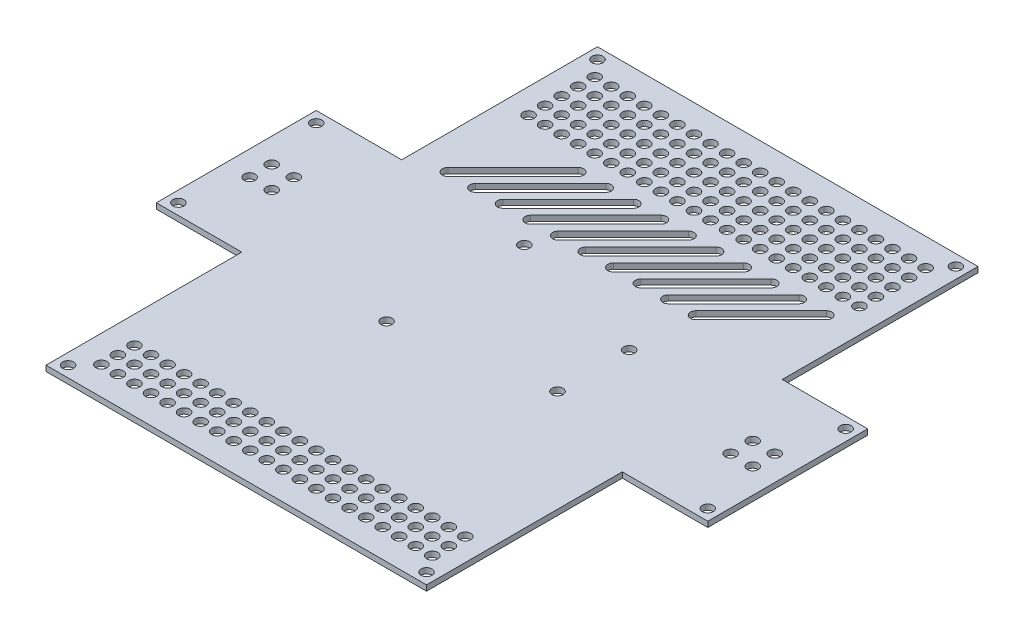
from build123d import *

# Parameters (mm, degrees)
SKETCH1_R           = 2
BOSS_EXTRUDE1_DEPTH = 2


with BuildPart() as part:
    # Sketch1 → Boss-Extrude1 (new body)
    with BuildSketch(Plane(origin=(0, 0, 0), x_dir=(1, 0, 0), z_dir=(0, 1, 0))):
        Polygon((-69, -100), (69, -100), (69, -29), (100, -29), (100, 29), (69, 29), (69, 100), (-69, 100), (-69, 29), (-100, 29), (-100, -29), (-69, -29), align=None)
        with Locations(Location((65, 96, 0), (0, 0, 270))):
            Circle(SKETCH1_R, mode=Mode.SUBTRACT)
        with Locations(Location((-65, 96, 0), (0, 0, 270))):
            Circle(SKETCH1_R, mode=Mode.SUBTRACT)
        with Locations(Location((96, 25, 0), (0, 0, 270))):
            Circle(SKETCH1_R, mode=Mode.SUBTRACT)
        with Locations(Location((96, -25, 0), (0, 0, 270))):
            Circle(SKETCH1_R, mode=Mode.SUBTRACT)
        with Locations(Location((65, -96, 0), (0, 0, 270))):
            Circle(SKETCH1_R, mode=Mode.SUBTRACT)
        with Locations(Location((-65, -96, 0), (0, 0, 270))):
            Circle(SKETCH1_R, mode=Mode.SUBTRACT)
        with Locations(Location((-96, -25, 0), (0, 0, 270))):
            Circle(SKETCH1_R, mode=Mode.SUBTRACT)
        with Locations(Location((-96, 25, 0), (0, 0, 270))):
            Circle(SKETCH1_R, mode=Mode.SUBTRACT)
        with Locations(Location((-60, 90, 0), (0, 0, 270))):
            Circle(SKETCH1_R, mode=Mode.SUBTRACT)
        with Locations(Location((-54, 90, 0), (0, 0, 270))):
            Circle(SKETCH1_R, mode=Mode.SUBTRACT)
        with Locations(Location((-48, 90, 0), (0, 0, 270))):
            Circle(SKETCH1_R, mode=Mode.SUBTRACT)
        with Locations(Location((-42, 90, 0), (0, 0, 270))):
            Circle(SKETCH1_R, mode=Mode.SUBTRACT)
        with Locations(Location((-36, 90, 0), (0, 0, 270))):
            Circle(SKETCH1_R, mode=Mode.SUBTRACT)
        with Locations(Location((-30, 90, 0), (0, 0, 270))):
            Circle(SKETCH1_R, mode=Mode.SUBTRACT)
        with Locations(Location((-24, 90, 0), (0, 0, 270))):
            Circle(SKETCH1_R, mode=Mode.SUBTRACT)
        with Locations(Location((-18, 90, 0), (0, 0, 270))):
            Circle(SKETCH1_R, mode=Mode.SUBTRACT)
        with Locations(Location((-12, 90, 0), (0, 0, 270))):
            Circle(SKETCH1_R, mode=Mode.SUBTRACT)
        with Locations(Location((-6, 90, 0), (0, 0, 270))):
            Circle(SKETCH1_R, mode=Mode.SUBTRACT)
        with Locations(Location((0, 90, 0), (0, 0, 270))):
            Circle(SKETCH1_R, mode=Mode.SUBTRACT)
        with Locations(Location((6, 90, 0), (0, 0, 270))):
            Circle(SKETCH1_R, mode=Mode.SUBTRACT)
        with Locations(Location((12, 90, 0), (0, 0, 270))):
            Circle(SKETCH1_R, mode=Mode.SUBTRACT)
        with Locations(Location((18, 90, 0), (0, 0, 270))):
            Circle(SKETCH1_R, mode=Mode.SUBTRACT)
        with Locations(Location((24, 90, 0), (0, 0, 270))):
            Circle(SKETCH1_R, mode=Mode.SUBTRACT)
        with Locations(Location((30, 90, 0), (0, 0, 270))):
            Circle(SKETCH1_R, mode=Mode.SUBTRACT)
        with Locations(Location((36, 90, 0), (0, 0, 270))):
            Circle(SKETCH1_R, mode=Mode.SUBTRACT)
        with Locations(Location((42, 90, 0), (0, 0, 270))):
            Circle(SKETCH1_R, mode=Mode.SUBTRACT)
        with Locations(Location((48, 90, 0), (0, 0, 270))):
            Circle(SKETCH1_R, mode=Mode.SUBTRACT)
        with Locations(Location((54, 90, 0), (0, 0, 270))):
            Circle(SKETCH1_R, mode=Mode.SUBTRACT)
        with Locations(Location((60, 90, 0), (0, 0, 270))):
            Circle(SKETCH1_R, mode=Mode.SUBTRACT)
        with Locations(Location((-54, 84, 0), (0, 0, 270))):
            Circle(SKETCH1_R, mode=Mode.SUBTRACT)
        with Locations(Location((-48, 84, 0), (0, 0, 270))):
            Circle(SKETCH1_R, mode=Mode.SUBTRACT)
        with Locations(Location((-42, 84, 0), (0, 0, 270))):
            Circle(SKETCH1_R, mode=Mode.SUBTRACT)
        with Locations(Location((-36, 84, 0), (0, 0, 270))):
            Circle(SKETCH1_R, mode=Mode.SUBTRACT)
        with Locations(Location((-30, 84, 0), (0, 0, 270))):
            Circle(SKETCH1_R, mode=Mode.SUBTRACT)
        with Locations(Location((-24, 84, 0), (0, 0, 270))):
            Circle(SKETCH1_R, mode=Mode.SUBTRACT)
        with Locations(Location((-18, 84, 0), (0, 0, 270))):
            Circle(SKETCH1_R, mode=Mode.SUBTRACT)
        with Locations(Location((-12, 84, 0), (0, 0, 270))):
            Circle(SKETCH1_R, mode=Mode.SUBTRACT)
        with Locations(Location((-6, 84, 0), (0, 0, 270))):
            Circle(SKETCH1_R, mode=Mode.SUBTRACT)
        with Locations(Location((0, 84, 0), (0, 0, 270))):
            Circle(SKETCH1_R, mode=Mode.SUBTRACT)
        with Locations(Location((6, 84, 0), (0, 0, 270))):
            Circle(SKETCH1_R, mode=Mode.SUBTRACT)
        with Locations(Location((12, 84, 0), (0, 0, 270))):
            Circle(SKETCH1_R, mode=Mode.SUBTRACT)
        with Locations(Location((18, 84, 0), (0, 0, 270))):
            Circle(SKETCH1_R, mode=Mode.SUBTRACT)
        with Locations(Location((24, 84, 0), (0, 0, 270))):
            Circle(SKETCH1_R, mode=Mode.SUBTRACT)
        with Locations(Location((30, 84, 0), (0, 0, 270))):
            Circle(SKETCH1_R, mode=Mode.SUBTRACT)
        with Locations(Location((36, 84, 0), (0, 0, 270))):
            Circle(SKETCH1_R, mode=Mode.SUBTRACT)
        with Locations(Location((42, 84, 0), (0, 0, 270))):
            Circle(SKETCH1_R, mode=Mode.SUBTRACT)
        with Locations(Location((48, 84, 0), (0, 0, 270))):
            Circle(SKETCH1_R, mode=Mode.SUBTRACT)
        with Locations(Location((54, 84, 0), (0, 0, 270))):
            Circle(SKETCH1_R, mode=Mode.SUBTRACT)
        with Locations(Location((60, 84, 0), (0, 0, 270))):
            Circle(SKETCH1_R, mode=Mode.SUBTRACT)
        with Locations(Location((-54, 78, 0), (0, 0, 270))):
            Circle(SKETCH1_R, mode=Mode.SUBTRACT)
        with Locations(Location((-48, 78, 0), (0, 0, 270))):
            Circle(SKETCH1_R, mode=Mode.SUBTRACT)
        with Locations(Location((-42, 78, 0), (0, 0, 270))):
            Circle(SKETCH1_R, mode=Mode.SUBTRACT)
        with Locations(Location((-36, 78, 0), (0, 0, 270))):
            Circle(SKETCH1_R, mode=Mode.SUBTRACT)
        with Locations(Location((-30, 78, 0), (0, 0, 270))):
            Circle(SKETCH1_R, mode=Mode.SUBTRACT)
        with Locations(Location((-24, 78, 0), (0, 0, 270))):
            Circle(SKETCH1_R, mode=Mode.SUBTRACT)
        with Locations(Location((-18, 78, 0), (0, 0, 270))):
            Circle(SKETCH1_R, mode=Mode.SUBTRACT)
        with Locations(Location((-12, 78, 0), (0, 0, 270))):
            Circle(SKETCH1_R, mode=Mode.SUBTRACT)
        with Locations(Location((-6, 78, 0), (0, 0, 270))):
            Circle(SKETCH1_R, mode=Mode.SUBTRACT)
        with Locations(Location((0, 78, 0), (0, 0, 270))):
            Circle(SKETCH1_R, mode=Mode.SUBTRACT)
        with Locations(Location((6, 78, 0), (0, 0, 270))):
            Circle(SKETCH1_R, mode=Mode.SUBTRACT)
        with Locations(Location((12, 78, 0), (0, 0, 270))):
            Circle(SKETCH1_R, mode=Mode.SUBTRACT)
        with Locations(Location((18, 78, 0), (0, 0, 270))):
            Circle(SKETCH1_R, mode=Mode.SUBTRACT)
        with Locations(Location((24, 78, 0), (0, 0, 270))):
            Circle(SKETCH1_R, mode=Mode.SUBTRACT)
        with Locations(Location((30, 78, 0), (0, 0, 270))):
            Circle(SKETCH1_R, mode=Mode.SUBTRACT)
        with Locations(Location((36, 78, 0), (0, 0, 270))):
            Circle(SKETCH1_R, mode=Mode.SUBTRACT)
        with Locations(Location((42, 78, 0), (0, 0, 270))):
            Circle(SKETCH1_R, mode=Mode.SUBTRACT)
        with Locations(Location((48, 78, 0), (0, 0, 270))):
            Circle(SKETCH1_R, mode=Mode.SUBTRACT)
        with Locations(Location((54, 78, 0), (0, 0, 270))):
            Circle(SKETCH1_R, mode=Mode.SUBTRACT)
        with Locations(Location((60, 78, 0), (0, 0, 270))):
            Circle(SKETCH1_R, mode=Mode.SUBTRACT)
        with Locations(Location((-54, 72, 0), (0, 0, 270))):
            Circle(SKETCH1_R, mode=Mode.SUBTRACT)
        with Locations(Location((-48, 72, 0), (0, 0, 270))):
            Circle(SKETCH1_R, mode=Mode.SUBTRACT)
        with Locations(Location((-42, 72, 0), (0, 0, 270))):
            Circle(SKETCH1_R, mode=Mode.SUBTRACT)
        with Locations(Location((-36, 72, 0), (0, 0, 270))):
            Circle(SKETCH1_R, mode=Mode.SUBTRACT)
        with Locations(Location((-30, 72, 0), (0, 0, 270))):
            Circle(SKETCH1_R, mode=Mode.SUBTRACT)
        with Locations(Location((-24, 72, 0), (0, 0, 270))):
            Circle(SKETCH1_R, mode=Mode.SUBTRACT)
        with Locations(Location((-18, 72, 0), (0, 0, 270))):
            Circle(SKETCH1_R, mode=Mode.SUBTRACT)
        with Locations(Location((-12, 72, 0), (0, 0, 270))):
            Circle(SKETCH1_R, mode=Mode.SUBTRACT)
        with Locations(Location((-6, 72, 0), (0, 0, 270))):
            Circle(SKETCH1_R, mode=Mode.SUBTRACT)
        with Locations(Location((0, 72, 0), (0, 0, 270))):
            Circle(SKETCH1_R, mode=Mode.SUBTRACT)
        with Locations(Location((6, 72, 0), (0, 0, 270))):
            Circle(SKETCH1_R, mode=Mode.SUBTRACT)
        with Locations(Location((12, 72, 0), (0, 0, 270))):
            Circle(SKETCH1_R, mode=Mode.SUBTRACT)
        with Locations(Location((18, 72, 0), (0, 0, 270))):
            Circle(SKETCH1_R, mode=Mode.SUBTRACT)
        with Locations(Location((24, 72, 0), (0, 0, 270))):
            Circle(SKETCH1_R, mode=Mode.SUBTRACT)
        with Locations(Location((30, 72, 0), (0, 0, 270))):
            Circle(SKETCH1_R, mode=Mode.SUBTRACT)
        with Locations(Location((36, 72, 0), (0, 0, 270))):
            Circle(SKETCH1_R, mode=Mode.SUBTRACT)
        with Locations(Location((42, 72, 0), (0, 0, 270))):
            Circle(SKETCH1_R, mode=Mode.SUBTRACT)
        with Locations(Location((48, 72, 0), (0, 0, 270))):
            Circle(SKETCH1_R, mode=Mode.SUBTRACT)
        with Locations(Location((54, 72, 0), (0, 0, 270))):
            Circle(SKETCH1_R, mode=Mode.SUBTRACT)
        with Locations(Location((60, 72, 0), (0, 0, 270))):
            Circle(SKETCH1_R, mode=Mode.SUBTRACT)
        with Locations(Location((-54, 66, 0), (0, 0, 270))):
            Circle(SKETCH1_R, mode=Mode.SUBTRACT)
        with Locations(Location((-48, 66, 0), (0, 0, 270))):
            Circle(SKETCH1_R, mode=Mode.SUBTRACT)
        with Locations(Location((-42, 66, 0), (0, 0, 270))):
            Circle(SKETCH1_R, mode=Mode.SUBTRACT)
        with Locations(Location((-36, 66, 0), (0, 0, 270))):
            Circle(SKETCH1_R, mode=Mode.SUBTRACT)
        with Locations(Location((-30, 66, 0), (0, 0, 270))):
            Circle(SKETCH1_R, mode=Mode.SUBTRACT)
        with Locations(Location((-24, 66, 0), (0, 0, 270))):
            Circle(SKETCH1_R, mode=Mode.SUBTRACT)
        with Locations(Location((-18, 66, 0), (0, 0, 270))):
            Circle(SKETCH1_R, mode=Mode.SUBTRACT)
        with Locations(Location((-12, 66, 0), (0, 0, 270))):
            Circle(SKETCH1_R, mode=Mode.SUBTRACT)
        with Locations(Location((-6, 66, 0), (0, 0, 270))):
            Circle(SKETCH1_R, mode=Mode.SUBTRACT)
        with Locations(Location((0, 66, 0), (0, 0, 270))):
            Circle(SKETCH1_R, mode=Mode.SUBTRACT)
        with Locations(Location((6, 66, 0), (0, 0, 270))):
            Circle(SKETCH1_R, mode=Mode.SUBTRACT)
        with Locations(Location((12, 66, 0), (0, 0, 270))):
            Circle(SKETCH1_R, mode=Mode.SUBTRACT)
        with Locations(Location((18, 66, 0), (0, 0, 270))):
            Circle(SKETCH1_R, mode=Mode.SUBTRACT)
        with Locations(Location((24, 66, 0), (0, 0, 270))):
            Circle(SKETCH1_R, mode=Mode.SUBTRACT)
        with Locations(Location((30, 66, 0), (0, 0, 270))):
            Circle(SKETCH1_R, mode=Mode.SUBTRACT)
        with Locations(Location((36, 66, 0), (0, 0, 270))):
            Circle(SKETCH1_R, mode=Mode.SUBTRACT)
        with Locations(Location((42, 66, 0), (0, 0, 270))):
            Circle(SKETCH1_R, mode=Mode.SUBTRACT)
        with Locations(Location((48, 66, 0), (0, 0, 270))):
            Circle(SKETCH1_R, mode=Mode.SUBTRACT)
        with Locations(Location((54, 66, 0), (0, 0, 270))):
            Circle(SKETCH1_R, mode=Mode.SUBTRACT)
        with Locations(Location((60, 66, 0), (0, 0, 270))):
            Circle(SKETCH1_R, mode=Mode.SUBTRACT)
        with Locations(Location((-53.147053671, -77.771185697, 0), (0, 0, 270))):
            Circle(SKETCH1_R, mode=Mode.SUBTRACT)
        with Locations(Location((-47.147053671, -77.771185697, 0), (0, 0, 270))):
            Circle(SKETCH1_R, mode=Mode.SUBTRACT)
        with Locations(Location((-41.147053671, -77.771185697, 0), (0, 0, 270))):
            Circle(SKETCH1_R, mode=Mode.SUBTRACT)
        with Locations(Location((-35.147053671, -77.771185697, 0), (0, 0, 270))):
            Circle(SKETCH1_R, mode=Mode.SUBTRACT)
        with Locations(Location((-29.147053671, -77.771185697, 0), (0, 0, 270))):
            Circle(SKETCH1_R, mode=Mode.SUBTRACT)
        with Locations(Location((-23.147053671, -77.771185697, 0), (0, 0, 270))):
            Circle(SKETCH1_R, mode=Mode.SUBTRACT)
        with Locations(Location((-17.147053671, -77.771185697, 0), (0, 0, 270))):
            Circle(SKETCH1_R, mode=Mode.SUBTRACT)
        with Locations(Location((-11.147053671, -77.771185697, 0), (0, 0, 270))):
            Circle(SKETCH1_R, mode=Mode.SUBTRACT)
        with Locations(Location((-5.147053671, -77.771185697, 0), (0, 0, 270))):
            Circle(SKETCH1_R, mode=Mode.SUBTRACT)
        with Locations(Location((0.852946329, -77.771185697, 0), (0, 0, 270))):
            Circle(SKETCH1_R, mode=Mode.SUBTRACT)
        with Locations(Location((6.852946329, -77.771185697, 0), (0, 0, 270))):
            Circle(SKETCH1_R, mode=Mode.SUBTRACT)
        with Locations(Location((12.852946329, -77.771185697, 0), (0, 0, 270))):
            Circle(SKETCH1_R, mode=Mode.SUBTRACT)
        with Locations(Location((18.852946329, -77.771185697, 0), (0, 0, 270))):
            Circle(SKETCH1_R, mode=Mode.SUBTRACT)
        with Locations(Location((24.852946329, -77.771185697, 0), (0, 0, 270))):
            Circle(SKETCH1_R, mode=Mode.SUBTRACT)
        with Locations(Location((30.852946329, -77.771185697, 0), (0, 0, 270))):
            Circle(SKETCH1_R, mode=Mode.SUBTRACT)
        with Locations(Location((36.852946329, -77.771185697, 0), (0, 0, 270))):
            Circle(SKETCH1_R, mode=Mode.SUBTRACT)
        with Locations(Location((42.852946329, -77.771185697, 0), (0, 0, 270))):
            Circle(SKETCH1_R, mode=Mode.SUBTRACT)
        with Locations(Location((48.852946329, -77.771185697, 0), (0, 0, 270))):
            Circle(SKETCH1_R, mode=Mode.SUBTRACT)
        with Locations(Location((54.852946329, -77.771185697, 0), (0, 0, 270))):
            Circle(SKETCH1_R, mode=Mode.SUBTRACT)
        with Locations(Location((60.852946329, -77.771185697, 0), (0, 0, 270))):
            Circle(SKETCH1_R, mode=Mode.SUBTRACT)
        with Locations(Location((-53.147053671, -83.771185697, 0), (0, 0, 270))):
            Circle(SKETCH1_R, mode=Mode.SUBTRACT)
        with Locations(Location((-47.147053671, -83.771185697, 0), (0, 0, 270))):
            Circle(SKETCH1_R, mode=Mode.SUBTRACT)
        with Locations(Location((-41.147053671, -83.771185697, 0), (0, 0, 270))):
            Circle(SKETCH1_R, mode=Mode.SUBTRACT)
        with Locations(Location((-35.147053671, -83.771185697, 0), (0, 0, 270))):
            Circle(SKETCH1_R, mode=Mode.SUBTRACT)
        with Locations(Location((-29.147053671, -83.771185697, 0), (0, 0, 270))):
            Circle(SKETCH1_R, mode=Mode.SUBTRACT)
        with Locations(Location((-23.147053671, -83.771185697, 0), (0, 0, 270))):
            Circle(SKETCH1_R, mode=Mode.SUBTRACT)
        with Locations(Location((-17.147053671, -83.771185697, 0), (0, 0, 270))):
            Circle(SKETCH1_R, mode=Mode.SUBTRACT)
        with Locations(Location((-11.147053671, -83.771185697, 0), (0, 0, 270))):
            Circle(SKETCH1_R, mode=Mode.SUBTRACT)
        with Locations(Location((-5.147053671, -83.771185697, 0), (0, 0, 270))):
            Circle(SKETCH1_R, mode=Mode.SUBTRACT)
        with Locations(Location((0.852946329, -83.771185697, 0), (0, 0, 270))):
            Circle(SKETCH1_R, mode=Mode.SUBTRACT)
        with Locations(Location((6.852946329, -83.771185697, 0), (0, 0, 270))):
            Circle(SKETCH1_R, mode=Mode.SUBTRACT)
        with Locations(Location((12.852946329, -83.771185697, 0), (0, 0, 270))):
            Circle(SKETCH1_R, mode=Mode.SUBTRACT)
        with Locations(Location((18.852946329, -83.771185697, 0), (0, 0, 270))):
            Circle(SKETCH1_R, mode=Mode.SUBTRACT)
        with Locations(Location((24.852946329, -83.771185697, 0), (0, 0, 270))):
            Circle(SKETCH1_R, mode=Mode.SUBTRACT)
        with Locations(Location((30.852946329, -83.771185697, 0), (0, 0, 270))):
            Circle(SKETCH1_R, mode=Mode.SUBTRACT)
        with Locations(Location((36.852946329, -83.771185697, 0), (0, 0, 270))):
            Circle(SKETCH1_R, mode=Mode.SUBTRACT)
        with Locations(Location((42.852946329, -83.771185697, 0), (0, 0, 270))):
            Circle(SKETCH1_R, mode=Mode.SUBTRACT)
        with Locations(Location((48.852946329, -83.771185697, 0), (0, 0, 270))):
            Circle(SKETCH1_R, mode=Mode.SUBTRACT)
        with Locations(Location((54.852946329, -83.771185697, 0), (0, 0, 270))):
            Circle(SKETCH1_R, mode=Mode.SUBTRACT)
        with Locations(Location((60.852946329, -83.771185697, 0), (0, 0, 270))):
            Circle(SKETCH1_R, mode=Mode.SUBTRACT)
        with Locations(Location((-53.147053671, -89.771185697, 0), (0, 0, 270))):
            Circle(SKETCH1_R, mode=Mode.SUBTRACT)
        with Locations(Location((-47.147053671, -89.771185697, 0), (0, 0, 270))):
            Circle(SKETCH1_R, mode=Mode.SUBTRACT)
        with Locations(Location((-41.147053671, -89.771185697, 0), (0, 0, 270))):
            Circle(SKETCH1_R, mode=Mode.SUBTRACT)
        with Locations(Location((-35.147053671, -89.771185697, 0), (0, 0, 270))):
            Circle(SKETCH1_R, mode=Mode.SUBTRACT)
        with Locations(Location((-29.147053671, -89.771185697, 0), (0, 0, 270))):
            Circle(SKETCH1_R, mode=Mode.SUBTRACT)
        with Locations(Location((-23.147053671, -89.771185697, 0), (0, 0, 270))):
            Circle(SKETCH1_R, mode=Mode.SUBTRACT)
        with Locations(Location((-17.147053671, -89.771185697, 0), (0, 0, 270))):
            Circle(SKETCH1_R, mode=Mode.SUBTRACT)
        with Locations(Location((-11.147053671, -89.771185697, 0), (0, 0, 270))):
            Circle(SKETCH1_R, mode=Mode.SUBTRACT)
        with Locations(Location((-5.147053671, -89.771185697, 0), (0, 0, 270))):
            Circle(SKETCH1_R, mode=Mode.SUBTRACT)
        with Locations(Location((0.852946329, -89.771185697, 0), (0, 0, 270))):
            Circle(SKETCH1_R, mode=Mode.SUBTRACT)
        with Locations(Location((6.852946329, -89.771185697, 0), (0, 0, 270))):
            Circle(SKETCH1_R, mode=Mode.SUBTRACT)
        with Locations(Location((12.852946329, -89.771185697, 0), (0, 0, 270))):
            Circle(SKETCH1_R, mode=Mode.SUBTRACT)
        with Locations(Location((18.852946329, -89.771185697, 0), (0, 0, 270))):
            Circle(SKETCH1_R, mode=Mode.SUBTRACT)
        with Locations(Location((24.852946329, -89.771185697, 0), (0, 0, 270))):
            Circle(SKETCH1_R, mode=Mode.SUBTRACT)
        with Locations(Location((30.852946329, -89.771185697, 0), (0, 0, 270))):
            Circle(SKETCH1_R, mode=Mode.SUBTRACT)
        with Locations(Location((36.852946329, -89.771185697, 0), (0, 0, 270))):
            Circle(SKETCH1_R, mode=Mode.SUBTRACT)
        with Locations(Location((42.852946329, -89.771185697, 0), (0, 0, 270))):
            Circle(SKETCH1_R, mode=Mode.SUBTRACT)
        with Locations(Location((48.852946329, -89.771185697, 0), (0, 0, 270))):
            Circle(SKETCH1_R, mode=Mode.SUBTRACT)
        with Locations(Location((54.852946329, -89.771185697, 0), (0, 0, 270))):
            Circle(SKETCH1_R, mode=Mode.SUBTRACT)
        with Locations(Location((60.852946329, -89.771185697, 0), (0, 0, 270))):
            Circle(SKETCH1_R, mode=Mode.SUBTRACT)
        with Locations(Location((-60, 84, 0), (0, 0, 270))):
            Circle(SKETCH1_R, mode=Mode.SUBTRACT)
        with Locations(Location((-60, 78, 0), (0, 0, 270))):
            Circle(SKETCH1_R, mode=Mode.SUBTRACT)
        with Locations(Location((-60, 72, 0), (0, 0, 270))):
            Circle(SKETCH1_R, mode=Mode.SUBTRACT)
        with Locations(Location((-60, 66, 0), (0, 0, 270))):
            Circle(SKETCH1_R, mode=Mode.SUBTRACT)
        with Locations(Location((-59.147053671, -77.771185697, 0), (0, 0, 270))):
            Circle(SKETCH1_R, mode=Mode.SUBTRACT)
        with Locations(Location((-59.147053671, -83.771185697, 0), (0, 0, 270))):
            Circle(SKETCH1_R, mode=Mode.SUBTRACT)
        with Locations(Location((-59.147053671, -89.771185697, 0), (0, 0, 270))):
            Circle(SKETCH1_R, mode=Mode.SUBTRACT)
        with Locations(Location((-20, 24.5, 0), (0, 0, 270))):
            Circle(SKETCH1_R, mode=Mode.SUBTRACT)
        with Locations(Location((32, 10.5, 0), (0, 0, 270))):
            Circle(SKETCH1_R, mode=Mode.SUBTRACT)
        with Locations(Location((32, -15.5, 0), (0, 0, 270))):
            Circle(SKETCH1_R, mode=Mode.SUBTRACT)
        with Locations(Location((-21, -24.5, 0), (0, 0, 270))):
            Circle(SKETCH1_R, mode=Mode.SUBTRACT)
        with Locations(Location((-91.10196002, 3.962916422, 0), (0, 0, 270))):
            Circle(SKETCH1_R, mode=Mode.SUBTRACT)
        with Locations(Location((-83.10196002, 3.962916422, 0), (0, 0, 270))):
            Circle(SKETCH1_R, mode=Mode.SUBTRACT)
        with Locations(Location((-91.10196002, -4.037083578, 0), (0, 0, 270))):
            Circle(SKETCH1_R, mode=Mode.SUBTRACT)
        with Locations(Location((-83.10196002, -4.037083578, 0), (0, 0, 270))):
            Circle(SKETCH1_R, mode=Mode.SUBTRACT)
        with Locations(Location((82.9273014, 4.368603658, 0), (0, 0, 270))):
            Circle(SKETCH1_R, mode=Mode.SUBTRACT)
        with Locations(Location((90.9273014, 4.368603658, 0), (0, 0, 270))):
            Circle(SKETCH1_R, mode=Mode.SUBTRACT)
        with Locations(Location((82.9273014, -3.631396342, 0), (0, 0, 270))):
            Circle(SKETCH1_R, mode=Mode.SUBTRACT)
        with Locations(Location((90.9273014, -3.631396342, 0), (0, 0, 270))):
            Circle(SKETCH1_R, mode=Mode.SUBTRACT)
        with BuildLine():
            Line((-31.767766953, 55.779810093), (-55.403805922, 32.143771124))
            ThreePointArc((-55.403805922, 32.143771124), (-58.232233047, 32.143771124), (-58.232233047, 34.972198248))
            Line((-58.232233047, 34.972198248), (-34.596194078, 58.608237218))
            ThreePointArc((-34.596194078, 58.608237218), (-31.767766953, 58.608237218), (-31.767766953, 55.779810093))
        make_face(mode=Mode.SUBTRACT)
        with BuildLine():
            Line((-21.767766953, 55.779810093), (-45.403805922, 32.143771124))
            ThreePointArc((-45.403805922, 32.143771124), (-48.232233047, 32.143771124), (-48.232233047, 34.972198248))
            Line((-48.232233047, 34.972198248), (-24.596194078, 58.608237218))
            ThreePointArc((-24.596194078, 58.608237218), (-21.767766953, 58.608237218), (-21.767766953, 55.779810093))
        make_face(mode=Mode.SUBTRACT)
        with BuildLine():
            Line((-11.767766953, 55.779810093), (-35.403805922, 32.143771124))
            ThreePointArc((-35.403805922, 32.143771124), (-38.232233047, 32.143771124), (-38.232233047, 34.972198248))
            Line((-38.232233047, 34.972198248), (-14.596194078, 58.608237218))
            ThreePointArc((-14.596194078, 58.608237218), (-11.767766953, 58.608237218), (-11.767766953, 55.779810093))
        make_face(mode=Mode.SUBTRACT)
        with BuildLine():
            Line((-1.767766953, 55.779810093), (-25.403805922, 32.143771124))
            ThreePointArc((-25.403805922, 32.143771124), (-28.232233047, 32.143771124), (-28.232233047, 34.972198248))
            Line((-28.232233047, 34.972198248), (-4.596194078, 58.608237218))
            ThreePointArc((-4.596194078, 58.608237218), (-1.767766953, 58.608237218), (-1.767766953, 55.779810093))
        make_face(mode=Mode.SUBTRACT)
        with BuildLine():
            Line((8.232233047, 55.779810093), (-15.403805922, 32.143771124))
            ThreePointArc((-15.403805922, 32.143771124), (-18.232233047, 32.143771124), (-18.232233047, 34.972198248))
            Line((-18.232233047, 34.972198248), (5.403805922, 58.608237218))
            ThreePointArc((5.403805922, 58.608237218), (8.232233047, 58.608237218), (8.232233047, 55.779810093))
        make_face(mode=Mode.SUBTRACT)
        with BuildLine():
            Line((18.232233047, 55.779810093), (-5.403805922, 32.143771124))
            ThreePointArc((-5.403805922, 32.143771124), (-8.232233047, 32.143771124), (-8.232233047, 34.972198248))
            Line((-8.232233047, 34.972198248), (15.403805922, 58.608237218))
            ThreePointArc((15.403805922, 58.608237218), (18.232233047, 58.608237218), (18.232233047, 55.779810093))
        make_face(mode=Mode.SUBTRACT)
        with BuildLine():
            Line((28.232233047, 55.779810093), (4.596194078, 32.143771124))
            ThreePointArc((4.596194078, 32.143771124), (1.767766953, 32.143771124), (1.767766953, 34.972198248))
            Line((1.767766953, 34.972198248), (25.403805922, 58.608237218))
            ThreePointArc((25.403805922, 58.608237218), (28.232233047, 58.608237218), (28.232233047, 55.779810093))
        make_face(mode=Mode.SUBTRACT)
        with BuildLine():
            Line((38.232233047, 55.779810093), (14.596194078, 32.143771124))
            ThreePointArc((14.596194078, 32.143771124), (11.767766953, 32.143771124), (11.767766953, 34.972198248))
            Line((11.767766953, 34.972198248), (35.403805922, 58.608237218))
            ThreePointArc((35.403805922, 58.608237218), (38.232233047, 58.608237218), (38.232233047, 55.779810093))
        make_face(mode=Mode.SUBTRACT)
        with BuildLine():
            Line((48.232233047, 55.779810093), (24.596194078, 32.143771124))
            ThreePointArc((24.596194078, 32.143771124), (21.767766953, 32.143771124), (21.767766953, 34.972198248))
            Line((21.767766953, 34.972198248), (45.403805922, 58.608237218))
            ThreePointArc((45.403805922, 58.608237218), (48.232233047, 58.608237218), (48.232233047, 55.779810093))
        make_face(mode=Mode.SUBTRACT)
        with BuildLine():
            Line((58.232233047, 55.779810093), (34.596194078, 32.143771124))
            ThreePointArc((34.596194078, 32.143771124), (31.767766953, 32.143771124), (31.767766953, 34.972198248))
            Line((31.767766953, 34.972198248), (55.403805922, 58.608237218))
            ThreePointArc((55.403805922, 58.608237218), (58.232233047, 58.608237218), (58.232233047, 55.779810093))
        make_face(mode=Mode.SUBTRACT)
    extrude(amount=BOSS_EXTRUDE1_DEPTH)


solid = part.part
